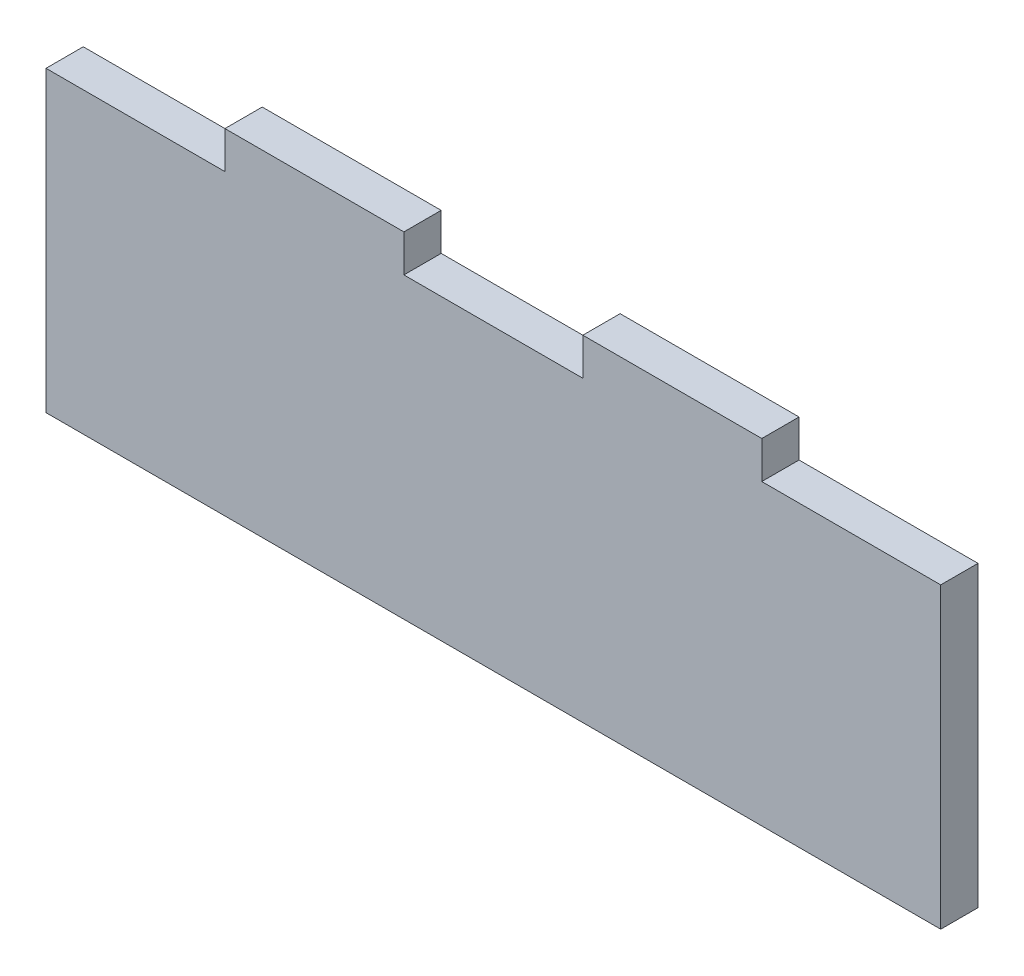
from build123d import *

# Parameters (mm, degrees)
BOSS_EXTRUDE1_DEPTH = 6.35


with BuildPart() as part:
    # Sketch2 → Boss-Extrude1 (new body)
    with BuildSketch(Plane.XY):
        Polygon((0, 50.8), (0, 0), (152.4, 0), (152.4, 50.8), (121.92, 50.8), (121.92, 57.15), (91.44, 57.15), (91.44, 50.8), (60.96, 50.8), (60.96, 57.15), (30.48, 57.15), (30.48, 50.8), align=None)
    extrude(amount=BOSS_EXTRUDE1_DEPTH)


solid = part.part
